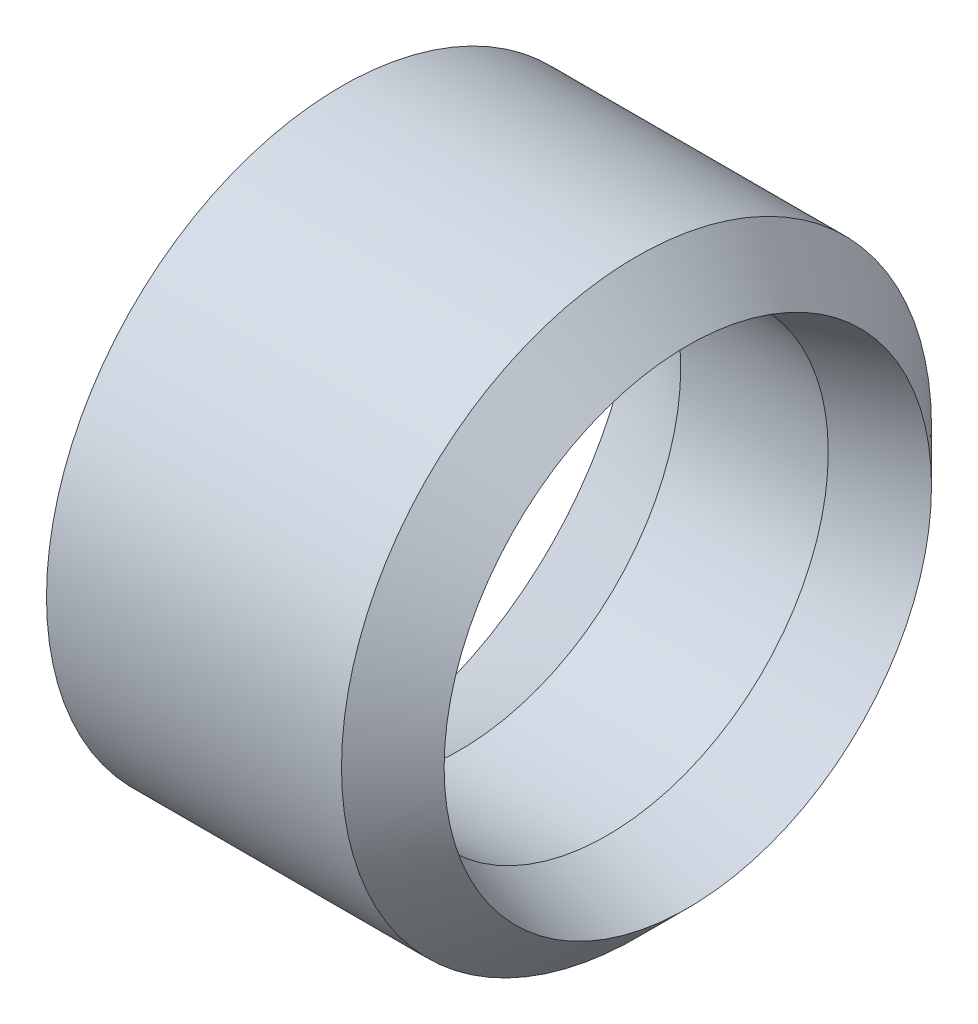
from build123d import *


with BuildPart() as part:
    # Sketch2 → Revolve2 (revolve)
    with BuildSketch(Plane.XY, mode=Mode.PRIVATE) as revolve2_sk:
        Polygon((-10.16, 25.4), (0, 19.05), (12.7, 19.05), (19.657391304, 20.982608696), (15.24, 25.4), align=None)
    revolve(revolve2_sk.sketch.rotate(Axis((0, 0, 0), (1, 0, 0)), 90), axis=Axis((0, 0, 0), (1, 0, 0)))


solid = part.part
